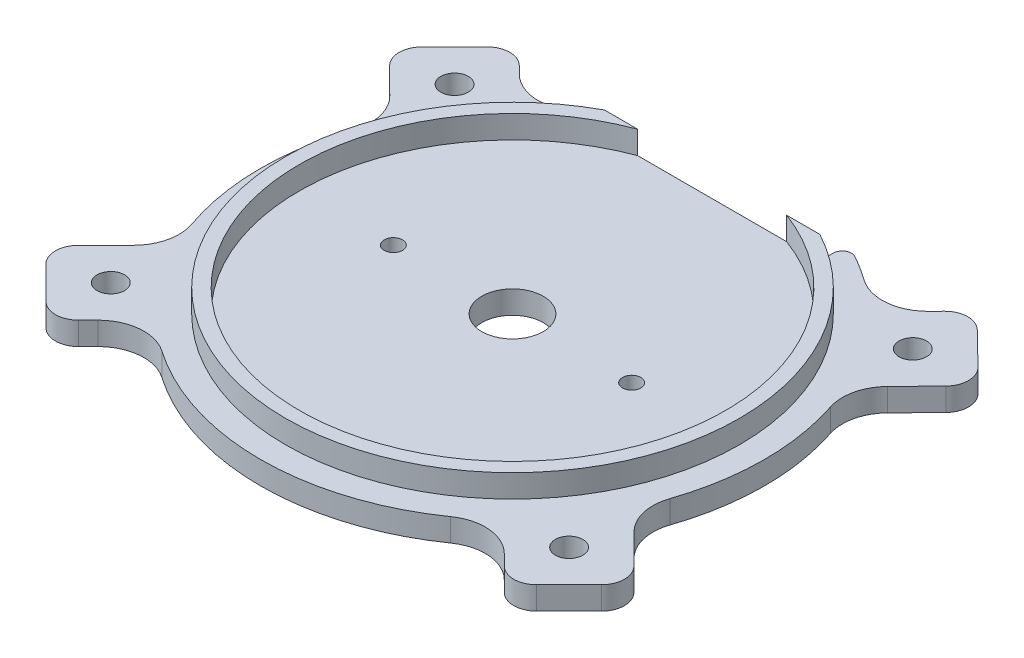
from build123d import *

# Parameters (mm, degrees)
SKETCH_1_R                  = 55
EXTRUDE_1_DEPTH             = 5
SKETCH_5_W                  = 47
SKETCH_5_H                  = 12.24289715
CUT_EXTRUDE_2_DEPTH         = 30
FILLET_4_R                  = 2
FILLET_5_R                  = 2
EXTRUDE_3_REACH             = 79.84
EXTRUDE_3_DIRECTION_2_REACH = 79.84
FILLET_7_R                  = 10
FILLET_8_R                  = 5
SKETCH_10_R                 = 3
CUT_EXTRUDE_5_DEPTH         = 5
SKETCH_15_R                 = 6.7
CUT_EXTRUDE_6_DEPTH         = 10
SKETCH_16_R                 = 2
CUT_EXTRUDE_7_DEPTH         = 10
EXTRUDE_4_DEPTH             = 5


with BuildPart() as part:
    # 草图1 → 凸台-拉伸1 (new body)
    with BuildSketch(Plane(origin=(0, 0, 0), x_dir=(1, 0, 0), z_dir=(0, 1, 0))):
        with Locations(Location((0, 0, 0), (0, 0, 270))):
            Circle(SKETCH_1_R)
    extrude(amount=EXTRUDE_1_DEPTH)

    # 草图5 → 切除-拉伸2 (cut)
    with BuildSketch(Plane(origin=(0, 5, 0), x_dir=(1, 0, 0), z_dir=(0, 1, 0))):
        with Locations((0, 49.687490397)):
            Rectangle(SKETCH_5_W, SKETCH_5_H)
    extrude(amount=-CUT_EXTRUDE_2_DEPTH, mode=Mode.SUBTRACT)

    # 圆角4
    fillet_4_edges = [part.edges().sort_by_distance(p)[0] for p in [
        (-23.5, 2.5, -49.726753363),
    ]]
    fillet(fillet_4_edges, radius=FILLET_4_R)

    # 圆角5
    fillet_5_edges = [part.edges().sort_by_distance(p)[0] for p in [
        (23.5, 2.5, -49.726753363),
    ]]
    fillet(fillet_5_edges, radius=FILLET_5_R)

    # 凸台-拉伸3: up to this face of the body (flat: up to its plane)
    extrude_3_end = Plane(part.part.faces().sort_by_distance((0, 0, 2.477505486))[0])
    # 草图14 → 凸台-拉伸3 (add, up to the picked face)
    with BuildSketch(Plane(origin=(0, 3, 0), x_dir=(1, 0, 0), z_dir=(0, 1, 0)), mode=Mode.PRIVATE) as extrude_3_sk1:
        with BuildLine():
            Line((-49.898576095, 23.132922507), (-63.862525635, 37.044772973))
            Line((-63.862525635, 37.044772973), (-49.746845912, 51.213315099))
            Line((-49.746845912, 51.213315099), (-38.128637352, 39.638453724))
            ThreePointArc((-38.128637352, 39.638453724), (-44.78063998, 31.932652301), (-49.898576095, 23.132922507))
        make_face()
    extrude_3_tool1 = split(extrude(extrude_3_sk1.sketch, amount=-EXTRUDE_3_REACH, mode=Mode.PRIVATE), bisect_by=extrude_3_end, keep=Keep.BOTH, mode=Mode.PRIVATE)
    # 草图14 → 凸台-拉伸3 (add, up to the picked face)
    with BuildSketch(Plane(origin=(0, 3, 0), x_dir=(1, 0, 0), z_dir=(0, 1, 0)), mode=Mode.PRIVATE) as extrude_3_sk2:
        with BuildLine():
            Line((49.811900188, -23.3189751), (64.421720913, -37.928795825))
            Line((64.421720913, -37.928795825), (50.279585289, -52.070931449))
            Line((50.279585289, -52.070931449), (37.984884655, -39.776230814))
            ThreePointArc((37.984884655, -39.776230814), (44.662950793, -32.097053236), (49.811900188, -23.3189751))
        make_face()
    extrude_3_tool2 = split(extrude(extrude_3_sk2.sketch, amount=-EXTRUDE_3_REACH, mode=Mode.PRIVATE), bisect_by=extrude_3_end, keep=Keep.BOTH, mode=Mode.PRIVATE)
    # 草图14 → 凸台-拉伸3 (add, up to the picked face)
    with BuildSketch(Plane(origin=(0, 3, 0), x_dir=(1, 0, 0), z_dir=(0, 1, 0)), mode=Mode.PRIVATE) as extrude_3_sk3:
        with BuildLine():
            Line((-49.632393674, -23.698639164), (-63.862550335, -37.928795825))
            Line((-63.862550335, -37.928795825), (-49.720414711, -52.070931449))
            Line((-49.720414711, -52.070931449), (-37.697852746, -40.048369484))
            ThreePointArc((-37.697852746, -40.048369484), (-44.423770724, -32.427281642), (-49.632393674, -23.698639164))
        make_face()
    extrude_3_tool3 = split(extrude(extrude_3_sk3.sketch, amount=-EXTRUDE_3_REACH, mode=Mode.PRIVATE), bisect_by=extrude_3_end, keep=Keep.BOTH, mode=Mode.PRIVATE)
    # 草图14 → 凸台-拉伸3 (add, up to the picked face)
    with BuildSketch(Plane(origin=(0, 3, 0), x_dir=(1, 0, 0), z_dir=(0, 1, 0)), mode=Mode.PRIVATE) as extrude_3_sk4:
        with BuildLine():
            Line((38.475737251, 39.301623923), (50.118901666, 51.212426922))
            Line((50.118901666, 51.212426922), (64.420808036, 37.231887798))
            Line((64.420808036, 37.231887798), (50.134465219, 22.6171483))
            ThreePointArc((50.134465219, 22.6171483), (45.083643676, 31.50341367), (38.475737251, 39.301623923))
        make_face()
    extrude_3_tool4 = split(extrude(extrude_3_sk4.sketch, amount=-EXTRUDE_3_REACH, mode=Mode.PRIVATE), bisect_by=extrude_3_end, keep=Keep.BOTH, mode=Mode.PRIVATE)
    add(extrude_3_tool1.solids().sort_by(Axis((-50.837096, 3, -37.73966), (0, -1, 0)))[0])
    add(extrude_3_tool2.solids().sort_by(Axis((51.039653, 3, 38.272151), (0, -1, 0)))[0])
    add(extrude_3_tool3.solids().sort_by(Axis((-50.639154, 3, 38.439997), (0, -1, 0)))[0])
    add(extrude_3_tool4.solids().sort_by(Axis((51.238479, 3, -37.552164), (0, -1, 0)))[0])

    # 凸台-拉伸3 direction 2: up to this face of the body (flat: up to its plane)
    extrude_3_direction_2_end = Plane(part.part.faces().sort_by_distance((0, 5, 2.477505486))[0])
    # 草图14 → 凸台-拉伸3 direction 2 (add, up to the picked face)
    with BuildSketch(Plane(origin=(0, 3, 0), x_dir=(1, 0, 0), z_dir=(0, 1, 0)), mode=Mode.PRIVATE) as extrude_3_direction_2_sk1:
        with BuildLine():
            Line((-49.898576095, 23.132922507), (-63.862525635, 37.044772973))
            Line((-63.862525635, 37.044772973), (-49.746845912, 51.213315099))
            Line((-49.746845912, 51.213315099), (-38.128637352, 39.638453724))
            ThreePointArc((-38.128637352, 39.638453724), (-44.78063998, 31.932652301), (-49.898576095, 23.132922507))
        make_face()
    extrude_3_direction_2_tool1 = split(extrude(extrude_3_direction_2_sk1.sketch, amount=EXTRUDE_3_DIRECTION_2_REACH, mode=Mode.PRIVATE), bisect_by=extrude_3_direction_2_end, keep=Keep.BOTH, mode=Mode.PRIVATE)
    # 草图14 → 凸台-拉伸3 direction 2 (add, up to the picked face)
    with BuildSketch(Plane(origin=(0, 3, 0), x_dir=(1, 0, 0), z_dir=(0, 1, 0)), mode=Mode.PRIVATE) as extrude_3_direction_2_sk2:
        with BuildLine():
            Line((49.811900188, -23.3189751), (64.421720913, -37.928795825))
            Line((64.421720913, -37.928795825), (50.279585289, -52.070931449))
            Line((50.279585289, -52.070931449), (37.984884655, -39.776230814))
            ThreePointArc((37.984884655, -39.776230814), (44.662950793, -32.097053236), (49.811900188, -23.3189751))
        make_face()
    extrude_3_direction_2_tool2 = split(extrude(extrude_3_direction_2_sk2.sketch, amount=EXTRUDE_3_DIRECTION_2_REACH, mode=Mode.PRIVATE), bisect_by=extrude_3_direction_2_end, keep=Keep.BOTH, mode=Mode.PRIVATE)
    # 草图14 → 凸台-拉伸3 direction 2 (add, up to the picked face)
    with BuildSketch(Plane(origin=(0, 3, 0), x_dir=(1, 0, 0), z_dir=(0, 1, 0)), mode=Mode.PRIVATE) as extrude_3_direction_2_sk3:
        with BuildLine():
            Line((-49.632393674, -23.698639164), (-63.862550335, -37.928795825))
            Line((-63.862550335, -37.928795825), (-49.720414711, -52.070931449))
            Line((-49.720414711, -52.070931449), (-37.697852746, -40.048369484))
            ThreePointArc((-37.697852746, -40.048369484), (-44.423770724, -32.427281642), (-49.632393674, -23.698639164))
        make_face()
    extrude_3_direction_2_tool3 = split(extrude(extrude_3_direction_2_sk3.sketch, amount=EXTRUDE_3_DIRECTION_2_REACH, mode=Mode.PRIVATE), bisect_by=extrude_3_direction_2_end, keep=Keep.BOTH, mode=Mode.PRIVATE)
    # 草图14 → 凸台-拉伸3 direction 2 (add, up to the picked face)
    with BuildSketch(Plane(origin=(0, 3, 0), x_dir=(1, 0, 0), z_dir=(0, 1, 0)), mode=Mode.PRIVATE) as extrude_3_direction_2_sk4:
        with BuildLine():
            Line((38.475737251, 39.301623923), (50.118901666, 51.212426922))
            Line((50.118901666, 51.212426922), (64.420808036, 37.231887798))
            Line((64.420808036, 37.231887798), (50.134465219, 22.6171483))
            ThreePointArc((50.134465219, 22.6171483), (45.083643676, 31.50341367), (38.475737251, 39.301623923))
        make_face()
    extrude_3_direction_2_tool4 = split(extrude(extrude_3_direction_2_sk4.sketch, amount=EXTRUDE_3_DIRECTION_2_REACH, mode=Mode.PRIVATE), bisect_by=extrude_3_direction_2_end, keep=Keep.BOTH, mode=Mode.PRIVATE)
    add(extrude_3_direction_2_tool1.solids().sort_by(Axis((-50.837096, 3, -37.73966), (0, 1, 0)))[0])
    add(extrude_3_direction_2_tool2.solids().sort_by(Axis((51.039653, 3, 38.272151), (0, 1, 0)))[0])
    add(extrude_3_direction_2_tool3.solids().sort_by(Axis((-50.639154, 3, 38.439997), (0, 1, 0)))[0])
    add(extrude_3_direction_2_tool4.solids().sort_by(Axis((51.238479, 3, -37.552164), (0, 1, 0)))[0])

    # 圆角7
    fillet_7_edges = [part.edges().sort_by_distance(p)[0] for p in [
        (-38.128637352, 2.5, -39.638453724),
        (-49.898576095, 2.5, -23.132922507),
        (-49.632393674, 2.5, 23.698639164),
        (-37.697852746, 2.5, 40.048369484),
        (50.134465219, 2.5, -22.6171483),
        (38.475737251, 2.5, -39.301623923),
        (37.984884655, 2.5, 39.776230814),
        (49.811900188, 2.5, 23.3189751),
    ]]
    fillet(fillet_7_edges, radius=FILLET_7_R)

    # 圆角8
    fillet_8_edges = [part.edges().sort_by_distance(p)[0] for p in [
        (-63.862525635, 2.5, -37.044772973),
        (-49.746845912, 2.5, -51.213315099),
        (-49.720414711, 2.5, 52.070931449),
        (-63.862550335, 2.5, 37.928795825),
        (50.118901666, 2.5, -51.212426922),
        (64.420808036, 2.5, -37.231887798),
        (50.279585289, 2.5, 52.070931449),
        (64.421720913, 2.5, 37.928795825),
    ]]
    fillet(fillet_8_edges, radius=FILLET_8_R)

    # 草图10 → 切除-拉伸5 (cut, symmetric)
    with BuildSketch(Plane(origin=(0, 3, 0), x_dir=(1, 0, 0), z_dir=(0, 1, 0))):
        with Locations(Location((-49.720414711, 37.071204175, 0), (0, 0, 270))):
            Circle(SKETCH_10_R)
        with Locations(Location((50.279585289, 37.071204175, 0), (0, 0, 270))):
            Circle(SKETCH_10_R)
        with Locations(Location((-49.720414711, -37.928795825, 0), (0, 0, 270))):
            Circle(SKETCH_10_R)
        with Locations(Location((50.279585289, -37.928795825, 0), (0, 0, 270))):
            Circle(SKETCH_10_R)
    extrude(amount=CUT_EXTRUDE_5_DEPTH, both=True, mode=Mode.SUBTRACT)

    # 草图15 → 切除-拉伸6 (cut)
    with BuildSketch(Plane(origin=(0, 5, 0), x_dir=(1, 0, 0), z_dir=(0, 1, 0))):
        with Locations(Location((0, 0, 0), (0, 0, 270))):
            Circle(SKETCH_15_R)
    extrude(amount=-CUT_EXTRUDE_6_DEPTH, mode=Mode.SUBTRACT)

    # 草图16 → 切除-拉伸7 (cut)
    with BuildSketch(Plane(origin=(0, 5, 0), x_dir=(1, 0, 0), z_dir=(0, 1, 0))):
        with Locations(Location((-26, 0, 0), (0, 0, 270))):
            Circle(SKETCH_16_R)
        with Locations(Location((26, 0, 0), (0, 0, 270))):
            Circle(SKETCH_16_R)
    extrude(amount=-CUT_EXTRUDE_7_DEPTH, mode=Mode.SUBTRACT)

    # 草图17 → 凸台-拉伸4 (add)
    with BuildSketch(Plane(origin=(0, 5, 0), x_dir=(1, 0, 0), z_dir=(0, 1, 0))):
        with BuildLine():
            Line((-23.5, 43.566041822), (-16.255768207, 43.566041822))
            ThreePointArc((-16.255768207, 43.566041822), (0, -46.5), (16.255768207, 43.566041822))
            Line((16.255768207, 43.566041822), (23.5, 43.566041822))
            ThreePointArc((23.5, 43.566041822), (0, -49.5), (-23.5, 43.566041822))
        make_face()
    extrude(amount=EXTRUDE_4_DEPTH)


solid = part.part
